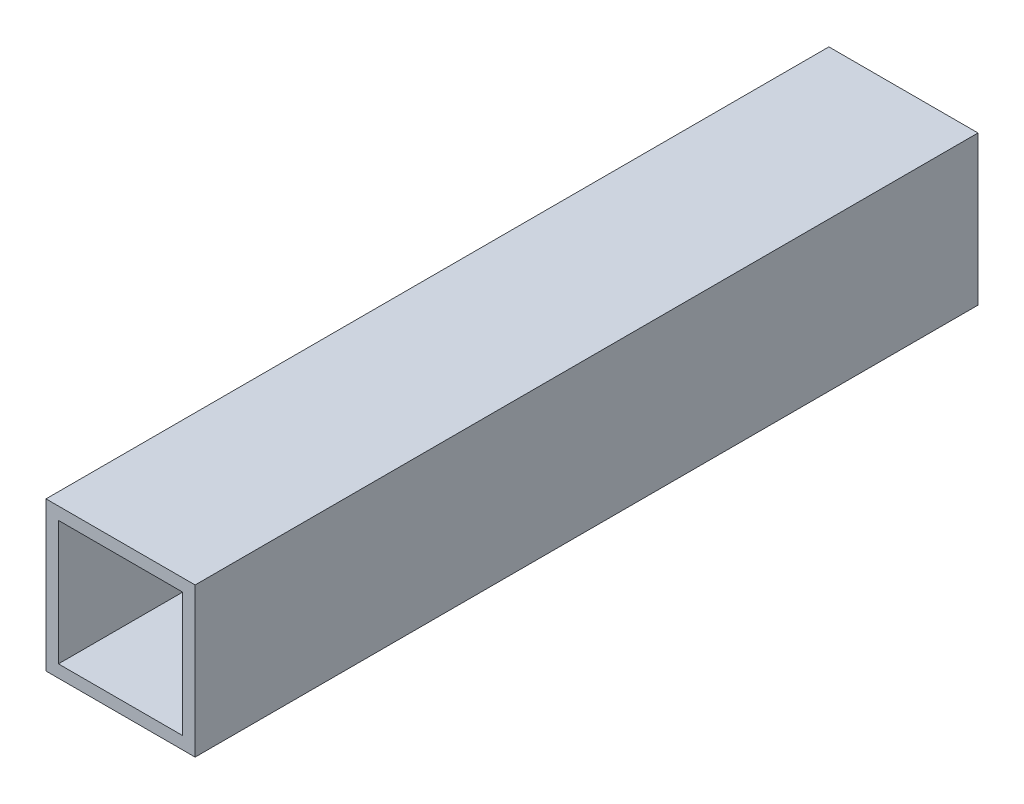
from build123d import *

# Parameters (mm, degrees)
SKETCH_1_W      = 24
SKETCH_1_H      = 24
SKETCH_1_W_2    = 20
SKETCH_1_H_2    = 20
EXTRUDE_1_DEPTH = 126


with BuildPart() as part:
    # 草图1 → 凸台-拉伸1 (new body)
    with BuildSketch(Plane.XY):
        Rectangle(SKETCH_1_W, SKETCH_1_H)
        Rectangle(SKETCH_1_W_2, SKETCH_1_H_2, mode=Mode.SUBTRACT)
    extrude(amount=EXTRUDE_1_DEPTH)


solid = part.part
